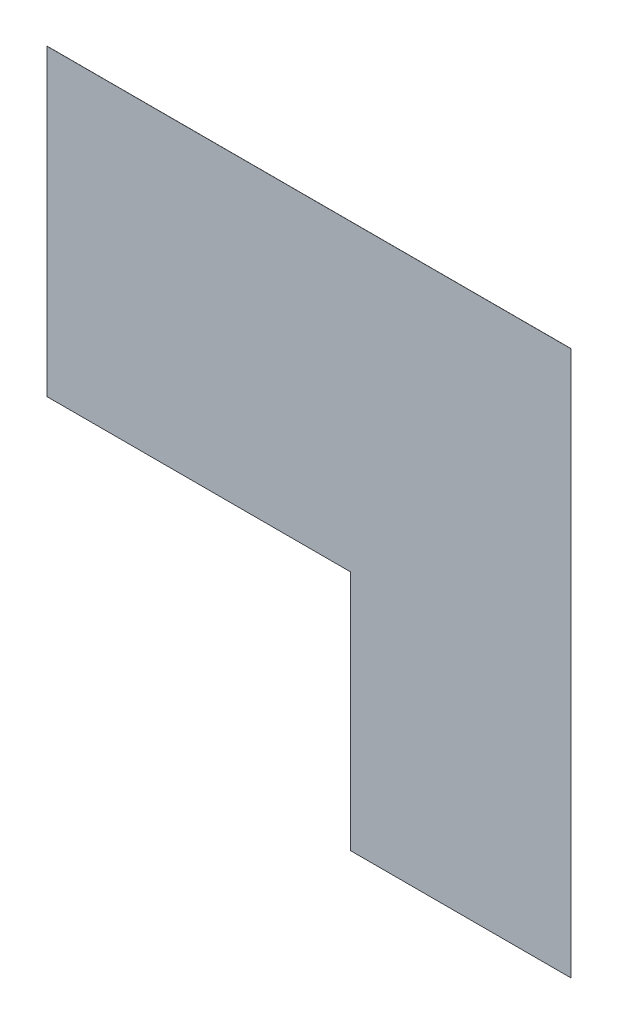
from build123d import *

# Parameters (mm, degrees)
SKETCH1_W           = 120.65
SKETCH1_H           = 69.85
BOSS_EXTRUDE1_DEPTH = 0.0254
SKETCH2_W           = 50.8
SKETCH2_H           = 55.5625
BOSS_EXTRUDE2_DEPTH = 0.0254


with BuildPart() as part:
    # Sketch1 → Boss-Extrude1 (new body)
    with BuildSketch(Plane.XY):
        with Locations((60.325, 34.925)):
            Rectangle(SKETCH1_W, SKETCH1_H)
    extrude(amount=BOSS_EXTRUDE1_DEPTH)

    # Sketch2 → Boss-Extrude2 (add)
    with BuildSketch(Plane.XY.offset(0.0254)):
        with Locations((95.25, -27.78125)):
            Rectangle(SKETCH2_W, SKETCH2_H)
    extrude(amount=-BOSS_EXTRUDE2_DEPTH)


solid = part.part
